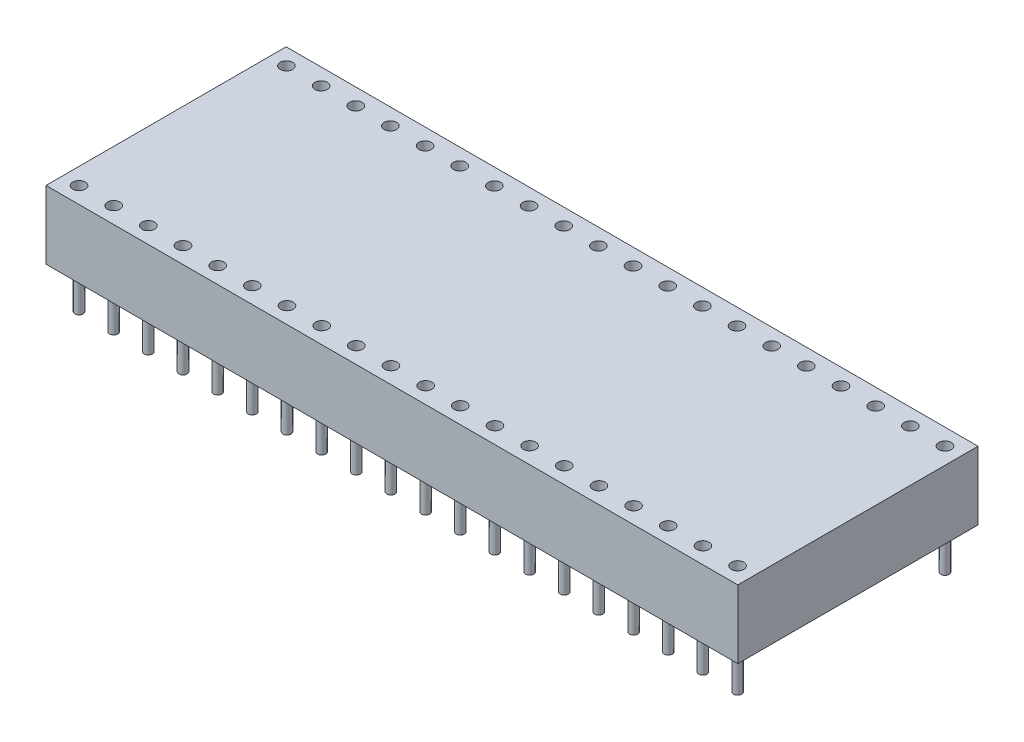
from build123d import *

# Parameters (mm, degrees)
SKETCH_1_W         = 50.7
SKETCH_1_H         = 17.6
SKETCH_1_R         = 0.4575
EXTRUDE_1_DEPTH    = 5
SKETCH_2_R         = 0.3
EXTRUDE_2_DEPTH    = 3
EXTRUDE_2_2_DEPTH  = 3
EXTRUDE_2_3_DEPTH  = 3
EXTRUDE_2_4_DEPTH  = 3
EXTRUDE_2_5_DEPTH  = 3
EXTRUDE_2_6_DEPTH  = 3
EXTRUDE_2_7_DEPTH  = 3
EXTRUDE_2_8_DEPTH  = 3
EXTRUDE_2_9_DEPTH  = 3
EXTRUDE_2_10_DEPTH = 3
EXTRUDE_2_11_DEPTH = 3
EXTRUDE_2_12_DEPTH = 3
EXTRUDE_2_13_DEPTH = 3
EXTRUDE_2_14_DEPTH = 3
EXTRUDE_2_15_DEPTH = 3
EXTRUDE_2_16_DEPTH = 3
EXTRUDE_2_17_DEPTH = 3
EXTRUDE_2_18_DEPTH = 3
EXTRUDE_2_19_DEPTH = 3
EXTRUDE_2_20_DEPTH = 3
EXTRUDE_2_21_DEPTH = 3
EXTRUDE_2_22_DEPTH = 3
EXTRUDE_2_23_DEPTH = 3
EXTRUDE_2_24_DEPTH = 3
EXTRUDE_2_25_DEPTH = 3
EXTRUDE_2_26_DEPTH = 3
EXTRUDE_2_27_DEPTH = 3
EXTRUDE_2_28_DEPTH = 3
EXTRUDE_2_29_DEPTH = 3
EXTRUDE_2_30_DEPTH = 3
EXTRUDE_2_31_DEPTH = 3
EXTRUDE_2_32_DEPTH = 3
EXTRUDE_2_33_DEPTH = 3
EXTRUDE_2_34_DEPTH = 3
EXTRUDE_2_35_DEPTH = 3
EXTRUDE_2_36_DEPTH = 3
EXTRUDE_2_37_DEPTH = 3
EXTRUDE_2_38_DEPTH = 3
EXTRUDE_2_39_DEPTH = 3
EXTRUDE_2_40_DEPTH = 3


with BuildPart() as part:
    # Эскиз1 → Бобышка-Вытянуть1 (new body)
    with BuildSketch(Plane(origin=(0, 0, 0), x_dir=(1, 0, 0), z_dir=(0, 1, 0))):
        Rectangle(SKETCH_1_W, SKETCH_1_H)
        with Locations(Location((-1.27, 7.6, 0), (0, 0, 270))):
            Circle(SKETCH_1_R, mode=Mode.SUBTRACT)
        with Locations(Location((1.27, 7.6, 0), (0, 0, 270))):
            Circle(SKETCH_1_R, mode=Mode.SUBTRACT)
        with Locations(Location((3.81, 7.6, 0), (0, 0, 270))):
            Circle(SKETCH_1_R, mode=Mode.SUBTRACT)
        with Locations(Location((6.35, 7.6, 0), (0, 0, 270))):
            Circle(SKETCH_1_R, mode=Mode.SUBTRACT)
        with Locations(Location((8.89, 7.6, 0), (0, 0, 270))):
            Circle(SKETCH_1_R, mode=Mode.SUBTRACT)
        with Locations(Location((11.43, 7.6, 0), (0, 0, 270))):
            Circle(SKETCH_1_R, mode=Mode.SUBTRACT)
        with Locations(Location((13.97, 7.6, 0), (0, 0, 270))):
            Circle(SKETCH_1_R, mode=Mode.SUBTRACT)
        with Locations(Location((16.51, 7.6, 0), (0, 0, 270))):
            Circle(SKETCH_1_R, mode=Mode.SUBTRACT)
        with Locations(Location((19.05, 7.6, 0), (0, 0, 270))):
            Circle(SKETCH_1_R, mode=Mode.SUBTRACT)
        with Locations(Location((21.59, 7.6, 0), (0, 0, 270))):
            Circle(SKETCH_1_R, mode=Mode.SUBTRACT)
        with Locations(Location((24.13, 7.6, 0), (0, 0, 270))):
            Circle(SKETCH_1_R, mode=Mode.SUBTRACT)
        with Locations(Location((24.13, -7.6, 0), (0, 0, 90))):
            Circle(SKETCH_1_R, mode=Mode.SUBTRACT)
        with Locations(Location((21.59, -7.6, 0), (0, 0, 90))):
            Circle(SKETCH_1_R, mode=Mode.SUBTRACT)
        with Locations(Location((19.05, -7.6, 0), (0, 0, 90))):
            Circle(SKETCH_1_R, mode=Mode.SUBTRACT)
        with Locations(Location((16.51, -7.6, 0), (0, 0, 90))):
            Circle(SKETCH_1_R, mode=Mode.SUBTRACT)
        with Locations(Location((13.97, -7.6, 0), (0, 0, 90))):
            Circle(SKETCH_1_R, mode=Mode.SUBTRACT)
        with Locations(Location((11.43, -7.6, 0), (0, 0, 90))):
            Circle(SKETCH_1_R, mode=Mode.SUBTRACT)
        with Locations(Location((8.89, -7.6, 0), (0, 0, 90))):
            Circle(SKETCH_1_R, mode=Mode.SUBTRACT)
        with Locations(Location((6.35, -7.6, 0), (0, 0, 90))):
            Circle(SKETCH_1_R, mode=Mode.SUBTRACT)
        with Locations(Location((3.81, -7.6, 0), (0, 0, 90))):
            Circle(SKETCH_1_R, mode=Mode.SUBTRACT)
        with Locations(Location((1.27, -7.6, 0), (0, 0, 90))):
            Circle(SKETCH_1_R, mode=Mode.SUBTRACT)
        with Locations(Location((-1.27, -7.6, 0), (0, 0, 90))):
            Circle(SKETCH_1_R, mode=Mode.SUBTRACT)
        with Locations(Location((-3.81, -7.6, 0), (0, 0, 90))):
            Circle(SKETCH_1_R, mode=Mode.SUBTRACT)
        with Locations(Location((-3.81, 7.6, 0), (0, 0, 270))):
            Circle(SKETCH_1_R, mode=Mode.SUBTRACT)
        with Locations(Location((-6.35, -7.6, 0), (0, 0, 90))):
            Circle(SKETCH_1_R, mode=Mode.SUBTRACT)
        with Locations(Location((-6.35, 7.6, 0), (0, 0, 270))):
            Circle(SKETCH_1_R, mode=Mode.SUBTRACT)
        with Locations(Location((-8.89, -7.6, 0), (0, 0, 90))):
            Circle(SKETCH_1_R, mode=Mode.SUBTRACT)
        with Locations(Location((-8.89, 7.6, 0), (0, 0, 270))):
            Circle(SKETCH_1_R, mode=Mode.SUBTRACT)
        with Locations(Location((-11.43, -7.6, 0), (0, 0, 90))):
            Circle(SKETCH_1_R, mode=Mode.SUBTRACT)
        with Locations(Location((-11.43, 7.6, 0), (0, 0, 270))):
            Circle(SKETCH_1_R, mode=Mode.SUBTRACT)
        with Locations(Location((-13.97, -7.6, 0), (0, 0, 90))):
            Circle(SKETCH_1_R, mode=Mode.SUBTRACT)
        with Locations(Location((-13.97, 7.6, 0), (0, 0, 270))):
            Circle(SKETCH_1_R, mode=Mode.SUBTRACT)
        with Locations(Location((-16.51, -7.6, 0), (0, 0, 90))):
            Circle(SKETCH_1_R, mode=Mode.SUBTRACT)
        with Locations(Location((-16.51, 7.6, 0), (0, 0, 270))):
            Circle(SKETCH_1_R, mode=Mode.SUBTRACT)
        with Locations(Location((-19.05, -7.6, 0), (0, 0, 90))):
            Circle(SKETCH_1_R, mode=Mode.SUBTRACT)
        with Locations(Location((-19.05, 7.6, 0), (0, 0, 270))):
            Circle(SKETCH_1_R, mode=Mode.SUBTRACT)
        with Locations(Location((-21.59, -7.6, 0), (0, 0, 90))):
            Circle(SKETCH_1_R, mode=Mode.SUBTRACT)
        with Locations(Location((-21.59, 7.6, 0), (0, 0, 270))):
            Circle(SKETCH_1_R, mode=Mode.SUBTRACT)
        with Locations(Location((-24.13, -7.6, 0), (0, 0, 90))):
            Circle(SKETCH_1_R, mode=Mode.SUBTRACT)
        with Locations(Location((-24.13, 7.6, 0), (0, 0, 270))):
            Circle(SKETCH_1_R, mode=Mode.SUBTRACT)
    extrude(amount=EXTRUDE_1_DEPTH)


with BuildPart() as body_2:
    # Эскиз2 → Бобышка-Вытянуть2 (new body)
    with BuildSketch(Plane.XZ):
        with Locations(Location((-24.13, 7.6, 0), (0, 0, 270))):
            Circle(SKETCH_2_R)
    extrude(amount=EXTRUDE_2_DEPTH)


with BuildPart() as body_3:
    # Эскиз2 → Extrude 2 2 (new body)
    with BuildSketch(Plane.XZ):
        with Locations(Location((-21.59, 7.6, 0), (0, 0, 270))):
            Circle(SKETCH_2_R)
    extrude(amount=EXTRUDE_2_2_DEPTH)


with BuildPart() as body_4:
    # Эскиз2 → Extrude 2 3 (new body)
    with BuildSketch(Plane.XZ):
        with Locations(Location((-19.05, 7.6, 0), (0, 0, 270))):
            Circle(SKETCH_2_R)
    extrude(amount=EXTRUDE_2_3_DEPTH)


with BuildPart() as body_5:
    # Эскиз2 → Extrude 2 4 (new body)
    with BuildSketch(Plane.XZ):
        with Locations(Location((-16.51, 7.6, 0), (0, 0, 270))):
            Circle(SKETCH_2_R)
    extrude(amount=EXTRUDE_2_4_DEPTH)


with BuildPart() as body_6:
    # Эскиз2 → Extrude 2 5 (new body)
    with BuildSketch(Plane.XZ):
        with Locations(Location((-13.97, 7.6, 0), (0, 0, 270))):
            Circle(SKETCH_2_R)
    extrude(amount=EXTRUDE_2_5_DEPTH)


with BuildPart() as body_7:
    # Эскиз2 → Extrude 2 6 (new body)
    with BuildSketch(Plane.XZ):
        with Locations(Location((-11.43, 7.6, 0), (0, 0, 270))):
            Circle(SKETCH_2_R)
    extrude(amount=EXTRUDE_2_6_DEPTH)


with BuildPart() as body_8:
    # Эскиз2 → Extrude 2 7 (new body)
    with BuildSketch(Plane.XZ):
        with Locations(Location((-8.89, 7.6, 0), (0, 0, 270))):
            Circle(SKETCH_2_R)
    extrude(amount=EXTRUDE_2_7_DEPTH)


with BuildPart() as body_9:
    # Эскиз2 → Extrude 2 8 (new body)
    with BuildSketch(Plane.XZ):
        with Locations(Location((-6.35, 7.6, 0), (0, 0, 270))):
            Circle(SKETCH_2_R)
    extrude(amount=EXTRUDE_2_8_DEPTH)


with BuildPart() as body_10:
    # Эскиз2 → Extrude 2 9 (new body)
    with BuildSketch(Plane.XZ):
        with Locations(Location((-3.81, 7.6, 0), (0, 0, 270))):
            Circle(SKETCH_2_R)
    extrude(amount=EXTRUDE_2_9_DEPTH)


with BuildPart() as body_11:
    # Эскиз2 → Extrude 2 10 (new body)
    with BuildSketch(Plane.XZ):
        with Locations(Location((-1.27, 7.6, 0), (0, 0, 270))):
            Circle(SKETCH_2_R)
    extrude(amount=EXTRUDE_2_10_DEPTH)


with BuildPart() as body_12:
    # Эскиз2 → Extrude 2 11 (new body)
    with BuildSketch(Plane.XZ):
        with Locations(Location((1.27, 7.6, 0), (0, 0, 270))):
            Circle(SKETCH_2_R)
    extrude(amount=EXTRUDE_2_11_DEPTH)


with BuildPart() as body_13:
    # Эскиз2 → Extrude 2 12 (new body)
    with BuildSketch(Plane.XZ):
        with Locations(Location((3.81, 7.6, 0), (0, 0, 270))):
            Circle(SKETCH_2_R)
    extrude(amount=EXTRUDE_2_12_DEPTH)


with BuildPart() as body_14:
    # Эскиз2 → Extrude 2 13 (new body)
    with BuildSketch(Plane.XZ):
        with Locations(Location((6.35, 7.6, 0), (0, 0, 270))):
            Circle(SKETCH_2_R)
    extrude(amount=EXTRUDE_2_13_DEPTH)


with BuildPart() as body_15:
    # Эскиз2 → Extrude 2 14 (new body)
    with BuildSketch(Plane.XZ):
        with Locations(Location((8.89, 7.6, 0), (0, 0, 270))):
            Circle(SKETCH_2_R)
    extrude(amount=EXTRUDE_2_14_DEPTH)


with BuildPart() as body_16:
    # Эскиз2 → Extrude 2 15 (new body)
    with BuildSketch(Plane.XZ):
        with Locations(Location((11.43, 7.6, 0), (0, 0, 270))):
            Circle(SKETCH_2_R)
    extrude(amount=EXTRUDE_2_15_DEPTH)


with BuildPart() as body_17:
    # Эскиз2 → Extrude 2 16 (new body)
    with BuildSketch(Plane.XZ):
        with Locations(Location((13.97, 7.6, 0), (0, 0, 270))):
            Circle(SKETCH_2_R)
    extrude(amount=EXTRUDE_2_16_DEPTH)


with BuildPart() as body_18:
    # Эскиз2 → Extrude 2 17 (new body)
    with BuildSketch(Plane.XZ):
        with Locations(Location((16.51, 7.6, 0), (0, 0, 270))):
            Circle(SKETCH_2_R)
    extrude(amount=EXTRUDE_2_17_DEPTH)


with BuildPart() as body_19:
    # Эскиз2 → Extrude 2 18 (new body)
    with BuildSketch(Plane.XZ):
        with Locations(Location((19.05, 7.6, 0), (0, 0, 270))):
            Circle(SKETCH_2_R)
    extrude(amount=EXTRUDE_2_18_DEPTH)


with BuildPart() as body_20:
    # Эскиз2 → Extrude 2 19 (new body)
    with BuildSketch(Plane.XZ):
        with Locations(Location((21.59, 7.6, 0), (0, 0, 270))):
            Circle(SKETCH_2_R)
    extrude(amount=EXTRUDE_2_19_DEPTH)


with BuildPart() as body_21:
    # Эскиз2 → Extrude 2 20 (new body)
    with BuildSketch(Plane.XZ):
        with Locations(Location((24.13, 7.6, 0), (0, 0, 270))):
            Circle(SKETCH_2_R)
    extrude(amount=EXTRUDE_2_20_DEPTH)


with BuildPart() as body_22:
    # Эскиз2 → Extrude 2 21 (new body)
    with BuildSketch(Plane.XZ):
        with Locations(Location((-21.59, -7.6, 0), (0, 0, 270))):
            Circle(SKETCH_2_R)
    extrude(amount=EXTRUDE_2_21_DEPTH)


with BuildPart() as body_23:
    # Эскиз2 → Extrude 2 22 (new body)
    with BuildSketch(Plane.XZ):
        with Locations(Location((-19.05, -7.6, 0), (0, 0, 270))):
            Circle(SKETCH_2_R)
    extrude(amount=EXTRUDE_2_22_DEPTH)


with BuildPart() as body_24:
    # Эскиз2 → Extrude 2 23 (new body)
    with BuildSketch(Plane.XZ):
        with Locations(Location((-16.51, -7.6, 0), (0, 0, 270))):
            Circle(SKETCH_2_R)
    extrude(amount=EXTRUDE_2_23_DEPTH)


with BuildPart() as body_25:
    # Эскиз2 → Extrude 2 24 (new body)
    with BuildSketch(Plane.XZ):
        with Locations(Location((-13.97, -7.6, 0), (0, 0, 270))):
            Circle(SKETCH_2_R)
    extrude(amount=EXTRUDE_2_24_DEPTH)


with BuildPart() as body_26:
    # Эскиз2 → Extrude 2 25 (new body)
    with BuildSketch(Plane.XZ):
        with Locations(Location((-11.43, -7.6, 0), (0, 0, 270))):
            Circle(SKETCH_2_R)
    extrude(amount=EXTRUDE_2_25_DEPTH)


with BuildPart() as body_27:
    # Эскиз2 → Extrude 2 26 (new body)
    with BuildSketch(Plane.XZ):
        with Locations(Location((-8.89, -7.6, 0), (0, 0, 270))):
            Circle(SKETCH_2_R)
    extrude(amount=EXTRUDE_2_26_DEPTH)


with BuildPart() as body_28:
    # Эскиз2 → Extrude 2 27 (new body)
    with BuildSketch(Plane.XZ):
        with Locations(Location((-6.35, -7.6, 0), (0, 0, 270))):
            Circle(SKETCH_2_R)
    extrude(amount=EXTRUDE_2_27_DEPTH)


with BuildPart() as body_29:
    # Эскиз2 → Extrude 2 28 (new body)
    with BuildSketch(Plane.XZ):
        with Locations(Location((-3.81, -7.6, 0), (0, 0, 270))):
            Circle(SKETCH_2_R)
    extrude(amount=EXTRUDE_2_28_DEPTH)


with BuildPart() as body_30:
    # Эскиз2 → Extrude 2 29 (new body)
    with BuildSketch(Plane.XZ):
        with Locations(Location((-1.27, -7.6, 0), (0, 0, 270))):
            Circle(SKETCH_2_R)
    extrude(amount=EXTRUDE_2_29_DEPTH)


with BuildPart() as body_31:
    # Эскиз2 → Extrude 2 30 (new body)
    with BuildSketch(Plane.XZ):
        with Locations(Location((1.27, -7.6, 0), (0, 0, 270))):
            Circle(SKETCH_2_R)
    extrude(amount=EXTRUDE_2_30_DEPTH)


with BuildPart() as body_32:
    # Эскиз2 → Extrude 2 31 (new body)
    with BuildSketch(Plane.XZ):
        with Locations(Location((3.81, -7.6, 0), (0, 0, 270))):
            Circle(SKETCH_2_R)
    extrude(amount=EXTRUDE_2_31_DEPTH)


with BuildPart() as body_33:
    # Эскиз2 → Extrude 2 32 (new body)
    with BuildSketch(Plane.XZ):
        with Locations(Location((6.35, -7.6, 0), (0, 0, 270))):
            Circle(SKETCH_2_R)
    extrude(amount=EXTRUDE_2_32_DEPTH)


with BuildPart() as body_34:
    # Эскиз2 → Extrude 2 33 (new body)
    with BuildSketch(Plane.XZ):
        with Locations(Location((8.89, -7.6, 0), (0, 0, 270))):
            Circle(SKETCH_2_R)
    extrude(amount=EXTRUDE_2_33_DEPTH)


with BuildPart() as body_35:
    # Эскиз2 → Extrude 2 34 (new body)
    with BuildSketch(Plane.XZ):
        with Locations(Location((11.43, -7.6, 0), (0, 0, 270))):
            Circle(SKETCH_2_R)
    extrude(amount=EXTRUDE_2_34_DEPTH)


with BuildPart() as body_36:
    # Эскиз2 → Extrude 2 35 (new body)
    with BuildSketch(Plane.XZ):
        with Locations(Location((13.97, -7.6, 0), (0, 0, 270))):
            Circle(SKETCH_2_R)
    extrude(amount=EXTRUDE_2_35_DEPTH)


with BuildPart() as body_37:
    # Эскиз2 → Extrude 2 36 (new body)
    with BuildSketch(Plane.XZ):
        with Locations(Location((16.51, -7.6, 0), (0, 0, 270))):
            Circle(SKETCH_2_R)
    extrude(amount=EXTRUDE_2_36_DEPTH)


with BuildPart() as body_38:
    # Эскиз2 → Extrude 2 37 (new body)
    with BuildSketch(Plane.XZ):
        with Locations(Location((19.05, -7.6, 0), (0, 0, 270))):
            Circle(SKETCH_2_R)
    extrude(amount=EXTRUDE_2_37_DEPTH)


with BuildPart() as body_39:
    # Эскиз2 → Extrude 2 38 (new body)
    with BuildSketch(Plane.XZ):
        with Locations(Location((21.59, -7.6, 0), (0, 0, 270))):
            Circle(SKETCH_2_R)
    extrude(amount=EXTRUDE_2_38_DEPTH)


with BuildPart() as body_40:
    # Эскиз2 → Extrude 2 39 (new body)
    with BuildSketch(Plane.XZ):
        with Locations(Location((24.13, -7.6, 0), (0, 0, 270))):
            Circle(SKETCH_2_R)
    extrude(amount=EXTRUDE_2_39_DEPTH)


with BuildPart() as body_41:
    # Эскиз2 → Extrude 2 40 (new body)
    with BuildSketch(Plane.XZ):
        with Locations(Location((-24.13, -7.6, 0), (0, 0, 270))):
            Circle(SKETCH_2_R)
    extrude(amount=EXTRUDE_2_40_DEPTH)


solid = Compound([part.part, body_2.part, body_3.part, body_4.part, body_5.part, body_6.part, body_7.part, body_8.part, body_9.part, body_10.part, body_11.part, body_12.part, body_13.part, body_14.part, body_15.part, body_16.part, body_17.part, body_18.part, body_19.part, body_20.part, body_21.part, body_22.part, body_23.part, body_24.part, body_25.part, body_26.part, body_27.part, body_28.part, body_29.part, body_30.part, body_31.part, body_32.part, body_33.part, body_34.part, body_35.part, body_36.part, body_37.part, body_38.part, body_39.part, body_40.part, body_41.part])
